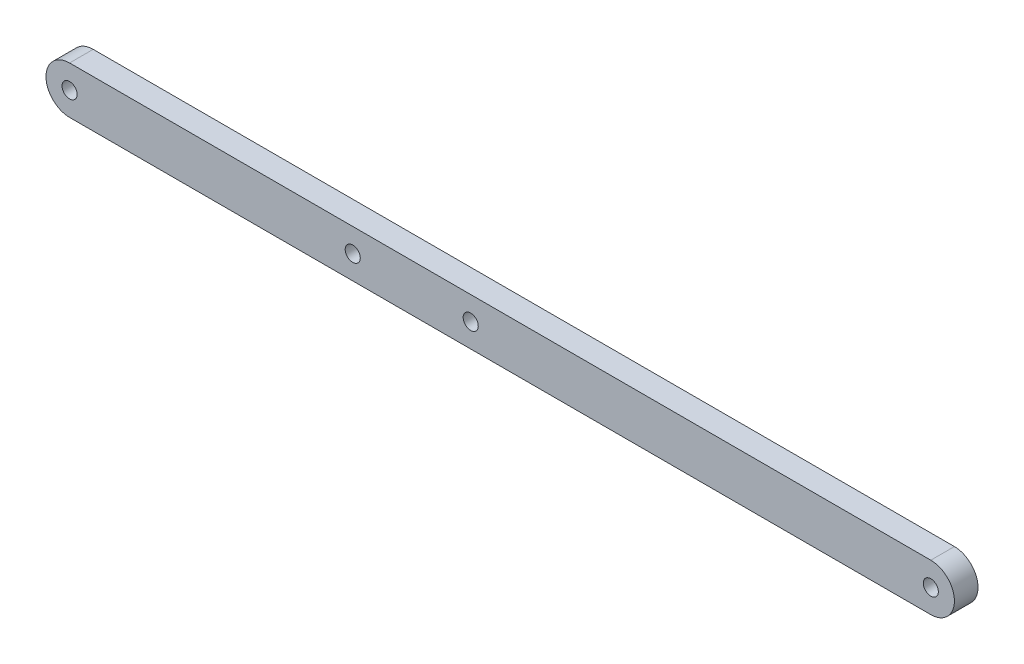
from build123d import *

# Parameters (mm, degrees)
SKETCH2_R           = 2.032
BOSS_EXTRUDE1_DEPTH = 3.175


with BuildPart() as part:
    # Sketch2 → Boss-Extrude1 (new, symmetric)
    with BuildSketch(Plane.XY):
        with BuildLine():
            Line((0, 6.35), (231.775, 6.35))
            ThreePointArc((231.775, 6.35), (238.125, 0), (231.775, -6.35))
            Line((231.775, -6.35), (0, -6.35))
            ThreePointArc((0, -6.35), (-6.35, 0), (0, 6.35))
        make_face()
        Circle(SKETCH2_R, mode=Mode.SUBTRACT)
        with Locations((231.775, 0)):
            Circle(SKETCH2_R, mode=Mode.SUBTRACT)
        with Locations((76.2, 0)):
            Circle(SKETCH2_R, mode=Mode.SUBTRACT)
        with Locations((107.95, 0)):
            Circle(SKETCH2_R, mode=Mode.SUBTRACT)
    extrude(amount=BOSS_EXTRUDE1_DEPTH, both=True)


solid = part.part
